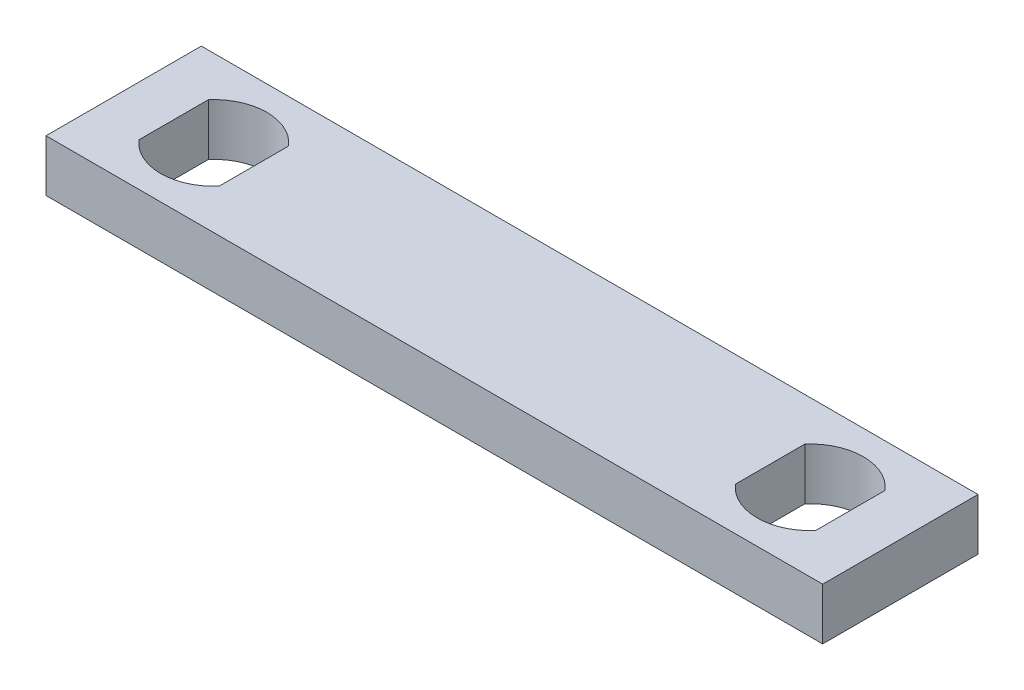
from build123d import *

# Parameters (mm, degrees)
SKETCH1_W           = 150
SKETCH1_H           = 30
BOSS_EXTRUDE1_DEPTH = 5
CUT_EXTRUDE1_DEPTH  = 78.136243103


with BuildPart() as part:
    # Sketch1 → Boss-Extrude1 (new, symmetric)
    with BuildSketch(Plane(origin=(0, 0, 0), x_dir=(1, 0, 0), z_dir=(0, 1, 0))):
        Rectangle(SKETCH1_W, SKETCH1_H)
    extrude(amount=BOSS_EXTRUDE1_DEPTH, both=True)

    # Sketch2 → Cut-Extrude1 (cut, through all)
    with BuildSketch(Plane(origin=(0, 5, 0), x_dir=(1, 0, 0), z_dir=(0, 1, 0))):
        with BuildLine():
            Line((-65.35, 6.708203932), (-65.35, -6.708203932))
            ThreePointArc((-65.35, -6.708203932), (-57.6, -10.25), (-49.85, -6.708203932))
            Line((-49.85, -6.708203932), (-49.85, 6.708203932))
            ThreePointArc((-49.85, 6.708203932), (-57.6, 10.25), (-65.35, 6.708203932))
        make_face()
    cut_extrude1 = extrude(amount=-CUT_EXTRUDE1_DEPTH, mode=Mode.SUBTRACT)

    # Mirror1: Cut-Extrude1 across plane
    add(cut_extrude1.mirror(Plane(origin=(0, 0, 0), x_dir=(0, 0, 1), z_dir=(1, 0, 0))), mode=Mode.SUBTRACT)


solid = part.part
